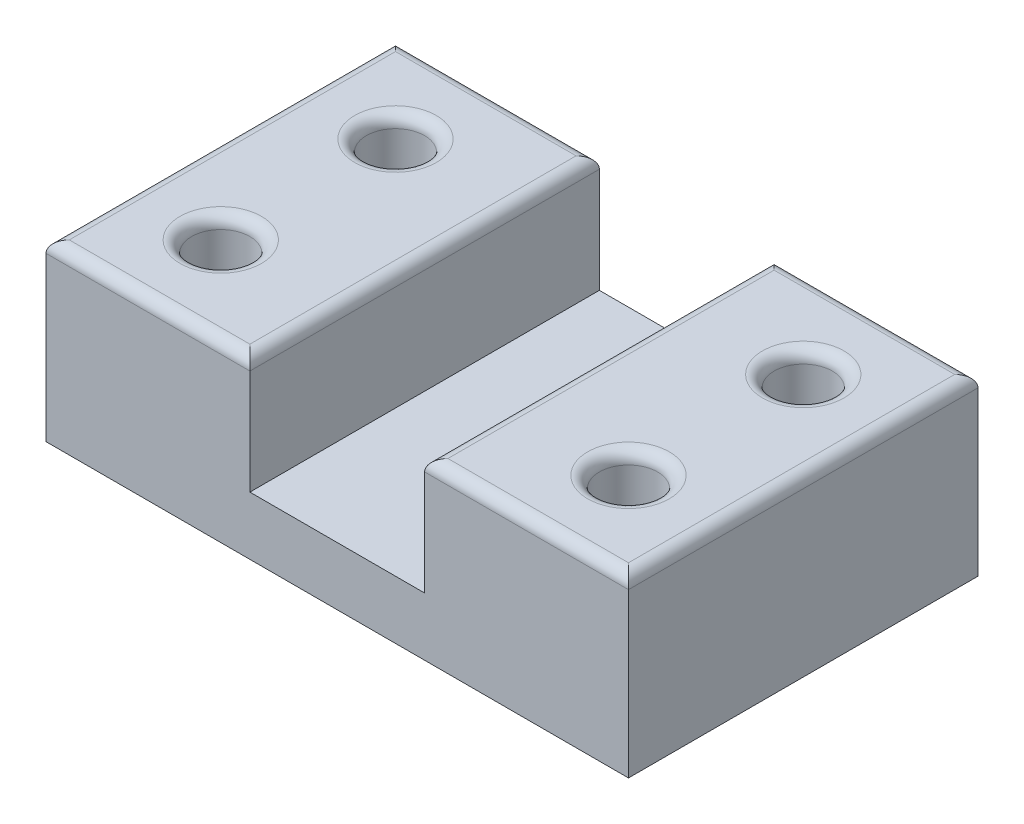
from build123d import *

# Parameters (mm, degrees)
BOSS_EXTRUDE1_DEPTH = 76.2
SKETCH2_R           = 6.35
CUT_EXTRUDE1_DEPTH  = 111.449174947
FILLET1_R           = 2.54


with BuildPart() as part:
    # Sketch1 → Boss-Extrude1 (new body)
    with BuildSketch(Plane.XY):
        Polygon((-56.707964559, -12.7), (70.292035441, -12.7), (70.292035441, 25.4), (25.842035441, 25.4), (25.842035441, 0), (-12.257964559, 0), (-12.257964559, 25.4), (-56.707964559, 25.4), align=None)
    extrude(amount=BOSS_EXTRUDE1_DEPTH)

    # Sketch2 → Cut-Extrude1 (cut, through all)
    with BuildSketch(Plane(origin=(0, 25.4, 0), x_dir=(1, 0, 0), z_dir=(0, 1, 0))):
        with Locations(Location((-37.657964559, -19.05, 0), (0, 0, 180))):
            Circle(SKETCH2_R)
        with Locations(Location((-37.657964559, -57.15, 0), (0, 0, 180))):
            Circle(SKETCH2_R)
        with Locations(Location((51.242035441, -19.05, 0), (0, 0, 180))):
            Circle(SKETCH2_R)
        with Locations(Location((51.242035441, -57.15, 0), (0, 0, 180))):
            Circle(SKETCH2_R)
    extrude(amount=-CUT_EXTRUDE1_DEPTH, mode=Mode.SUBTRACT)

    # Fillet1
    fillet1_edges = [part.edges().sort_by_distance(p)[0] for p in [
        (-34.482964559, 25.4, 0),
        (-12.257964559, 25.4, 38.1),
        (25.842035441, 25.4, 38.1),
        (70.292035441, 25.4, 38.1),
        (-56.707964559, 25.4, 38.1),
        (48.067035441, 25.4, 76.2),
        (-31.307964559, 25.4, 57.15),
        (57.592035441, 25.4, 19.05),
        (57.592035441, 25.4, 57.15),
        (-31.307964559, 25.4, 19.05),
        (-34.482964559, 25.4, 76.2),
        (48.067035441, 25.4, 0),
    ]]
    fillet(fillet1_edges, radius=FILLET1_R)


solid = part.part
